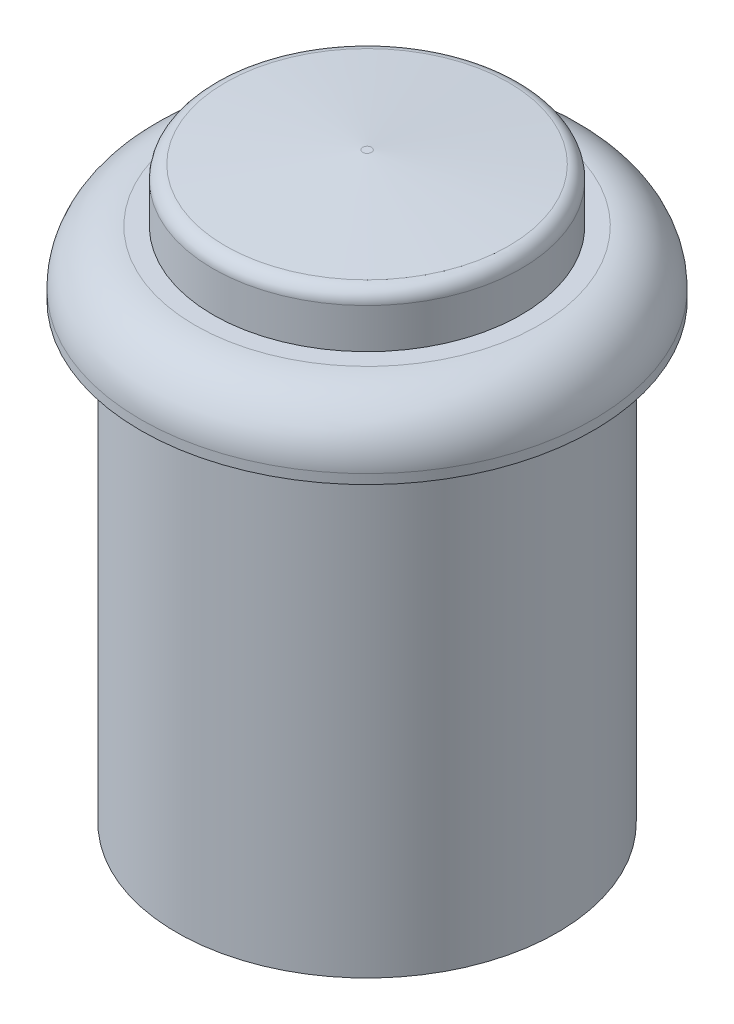
from build123d import *

# Parameters (mm, degrees)
SKETCH1_R           = 16.65
BOSS_EXTRUDE1_DEPTH = 4.7
SKETCH2_R           = 11.325
BOSS_EXTRUDE2_DEPTH = 4.85
SKETCH3_R           = 14
BOSS_EXTRUDE3_DEPTH = 33.3
FILLET1_R           = 4
CHAMFER1_SIZE       = 1
CHAMFER1_SIZE2      = 11
FILLET2_R           = 1


with BuildPart() as part:
    # Sketch1 → Boss-Extrude1 (new body)
    with BuildSketch(Plane(origin=(0, 0, 0), x_dir=(1, 0, 0), z_dir=(0, 1, 0))):
        with Locations(Location((0, 0, 0), (0, 0, 270))):
            Circle(SKETCH1_R)
    extrude(amount=BOSS_EXTRUDE1_DEPTH)

    # Sketch2 → Boss-Extrude2 (add)
    with BuildSketch(Plane(origin=(0, 4.7, 0), x_dir=(1, 0, 0), z_dir=(0, 1, 0))):
        with Locations(Location((0, 0, 0), (0, 0, 270))):
            Circle(SKETCH2_R)
    extrude(amount=BOSS_EXTRUDE2_DEPTH)

    # Sketch3 → Boss-Extrude3 (add)
    with BuildSketch(Plane.XZ):
        with Locations(Location((0, 0, 0), (0, 0, 270))):
            Circle(SKETCH3_R)
    extrude(amount=BOSS_EXTRUDE3_DEPTH)

    # Fillet1
    fillet1_edges = [part.edges().sort_by_distance(p)[0] for p in [
        (0, 4.7, -16.65),
    ]]
    fillet(fillet1_edges, radius=FILLET1_R)

    # Chamfer1
    chamfer1_edges = [part.edges().sort_by_distance(p)[0] for p in [
        (0, 9.55, -11.325),
    ]]
    chamfer1_side = [part.faces().sort_by_distance(p)[0] for p in [
        (0, 7.125, -11.325),
    ]]
    chamfer(chamfer1_edges, length=CHAMFER1_SIZE, length2=CHAMFER1_SIZE2, reference=chamfer1_side[0])

    # Fillet2
    fillet2_edges = [part.edges().sort_by_distance(p)[0] for p in [
        (0, 8.55, -11.325),
    ]]
    fillet(fillet2_edges, radius=FILLET2_R)


solid = part.part
